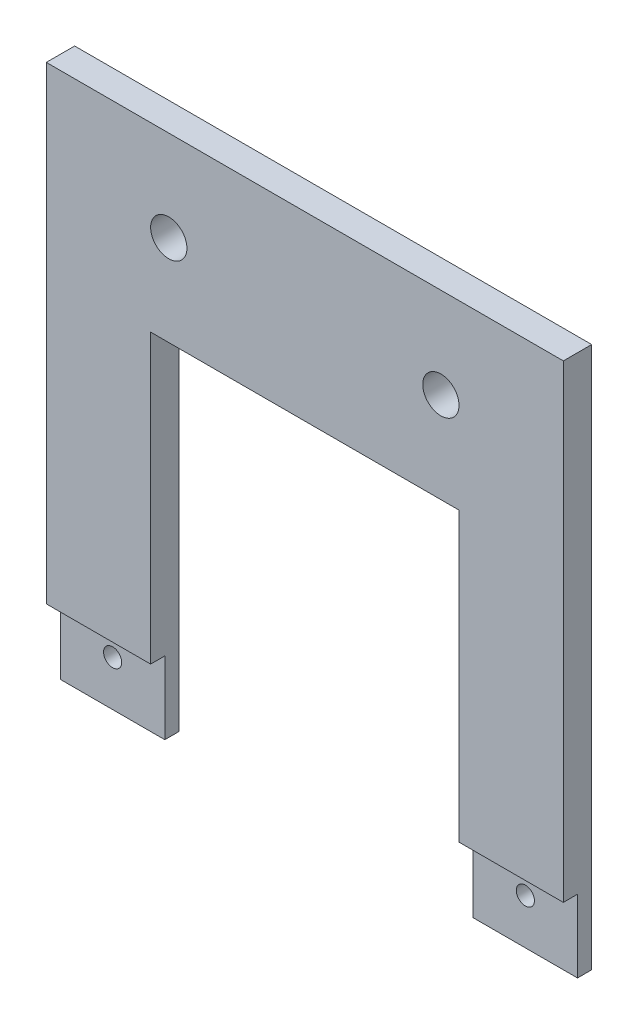
from build123d import *

# Parameters (mm, degrees)
SKETCH1_R           = 1
SKETCH1_R_2         = 0.5
BOSS_EXTRUDE1_DEPTH = 0.781250025
SKETCH2_W           = 5.75
SKETCH2_H           = 4
CUT_EXTRUDE1_DEPTH  = 0.781250025


with BuildPart() as part:
    # Sketch1 → Boss-Extrude1 (new, symmetric)
    with BuildSketch(Plane.XY):
        Polygon((-8.5, -19.85), (-8.5, 0), (8.5, 0), (8.5, -19.85), (14.25, -19.85), (14.25, 10), (-14.25, 10), (-14.25, -19.85), align=None)
        with Locations((-7.5, 5)):
            Circle(SKETCH1_R, mode=Mode.SUBTRACT)
        with Locations((7.5, 5)):
            Circle(SKETCH1_R, mode=Mode.SUBTRACT)
        with Locations((-11.375, -17.35)):
            Circle(SKETCH1_R_2, mode=Mode.SUBTRACT)
        with Locations((11.375, -17.35)):
            Circle(SKETCH1_R_2, mode=Mode.SUBTRACT)
    extrude(amount=BOSS_EXTRUDE1_DEPTH, both=True)

    # Sketch2 → Cut-Extrude1 (cut)
    with BuildSketch(Plane.XY.offset(0.781250025)):
        with Locations((-11.375, -17.85)):
            Rectangle(SKETCH2_W, SKETCH2_H)
        with Locations((11.375, -17.85)):
            Rectangle(SKETCH2_W, SKETCH2_H)
    extrude(amount=-CUT_EXTRUDE1_DEPTH, mode=Mode.SUBTRACT)


solid = part.part
